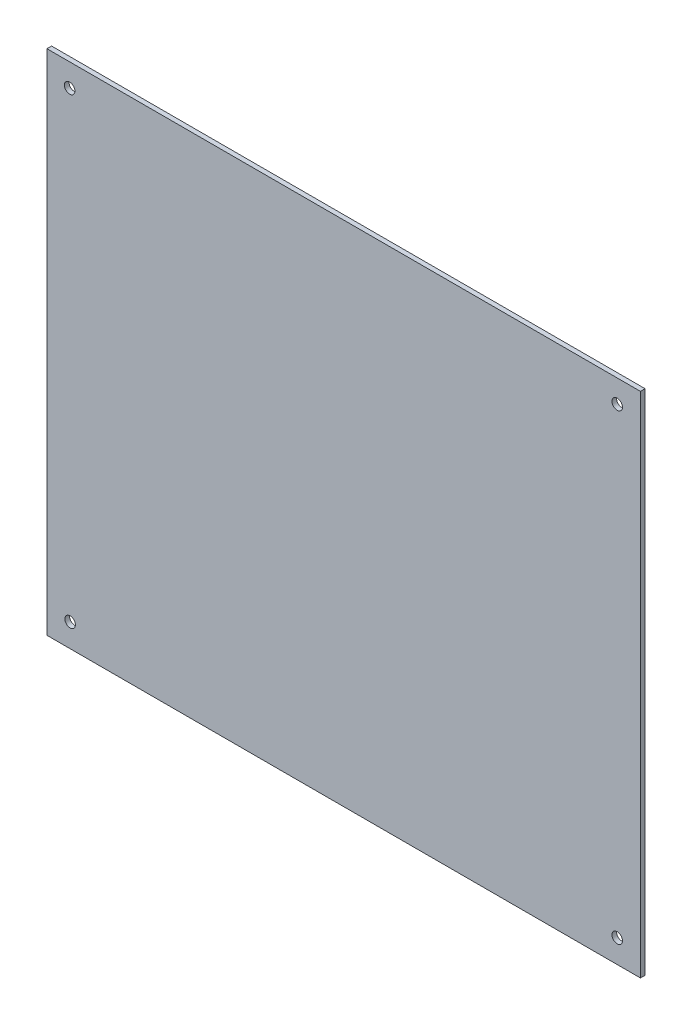
from build123d import *

# Parameters (mm, degrees)
SKETCH1_W             = 243.332
SKETCH1_H             = 208.28
BOSS_EXTRUDE1_DEPTH   = 1.905
F_6_CLEARANCE_HOLE1_D = 4.3053


with BuildPart() as part:
    # Sketch1 → Boss-Extrude1 (new body)
    with BuildSketch(Plane.XY):
        with Locations((121.666, 104.14)):
            Rectangle(SKETCH1_W, SKETCH1_H)
    extrude(amount=BOSS_EXTRUDE1_DEPTH)

    # #6 Clearance Hole1 (through all)
    with Locations(Plane.XY.offset(1.905)):
        with Locations((9.324999, 198.955001), (233.807, 198.955001), (233.807, 9.525), (9.525, 9.525)):
            Hole(F_6_CLEARANCE_HOLE1_D / 2)


solid = part.part
